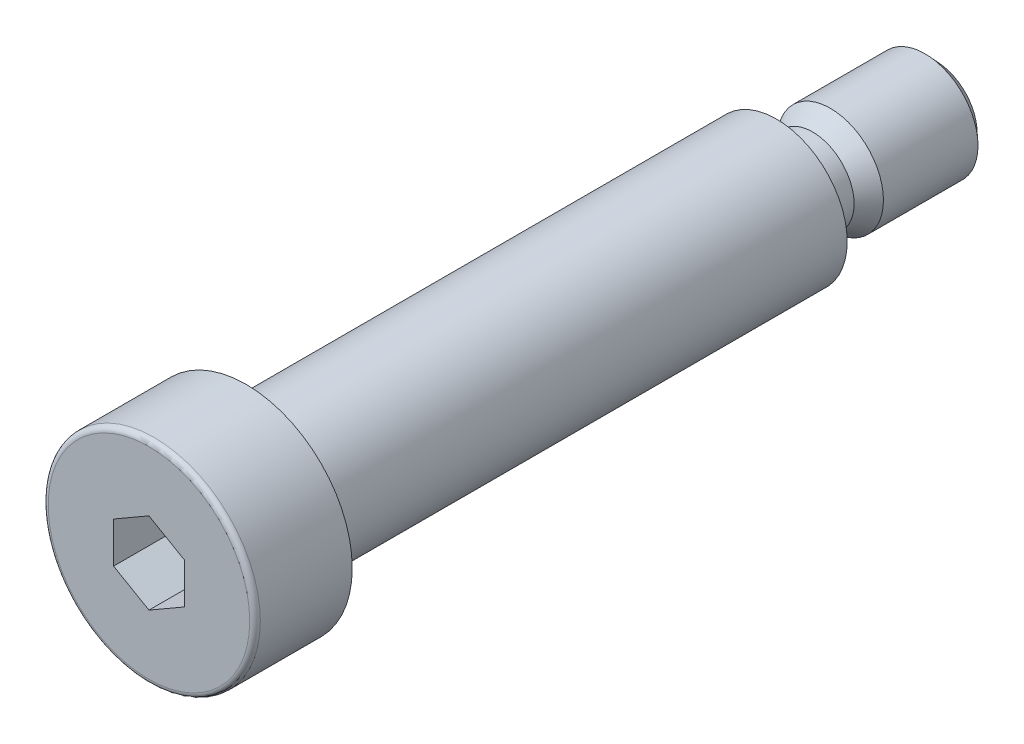
from build123d import *

# Parameters (mm, degrees)
SZKIC1_W                   = 4.7
SZKIC1_H                   = 4.08
WYTNIJ_WYCI_GNI_CIE1_DEPTH = 6.6
ZAOKR_GLENIE1_R            = 0.6


with BuildPart() as part:
    # Szkic1 → Obrót1 (revolve)
    with BuildSketch(Plane(origin=(0, 0, 0), x_dir=(1, 0, 0), z_dir=(0, 1, 0)), mode=Mode.PRIVATE) as obr_t1_sk:
        Polygon((0, -41), (0, -30), (-8, -30), (-12, -30), (-12, -41), align=None)
        Polygon((0, -30), (0, 30), (-4.7, 30), (-8, 30), (-8, -30), align=None)
        with Locations((-2.35, 32.04)):
            Rectangle(SZKIC1_W, SZKIC1_H)
        Polygon((-4.7, 34.08), (0, 34.08), (0, 48), (-4.7, 48), (-6, 46.8), (-6, 36.1), align=None)
    revolve(obr_t1_sk.sketch.rotate(Axis((0, 0, 41), (0, 0, -1)), 180), axis=Axis((0, 0, 41), (0, 0, -1)))

    # Szkic2 → Wytnij-wyciągnięcie1 (cut)
    with BuildSketch(Plane.XY.offset(41)):
        Polygon((4, 2.309401077), (0, 4.618802154), (-4, 2.309401077), (-4, -2.309401077), (0, -4.618802154), (4, -2.309401077), align=None)
    extrude(amount=-WYTNIJ_WYCI_GNI_CIE1_DEPTH, mode=Mode.SUBTRACT)

    # Zaokrąglenie1
    zaokr_glenie1_edges = [part.edges().sort_by_distance(p)[0] for p in [
        (-12, 0, 41),
    ]]
    fillet(zaokr_glenie1_edges, radius=ZAOKR_GLENIE1_R)


solid = part.part
